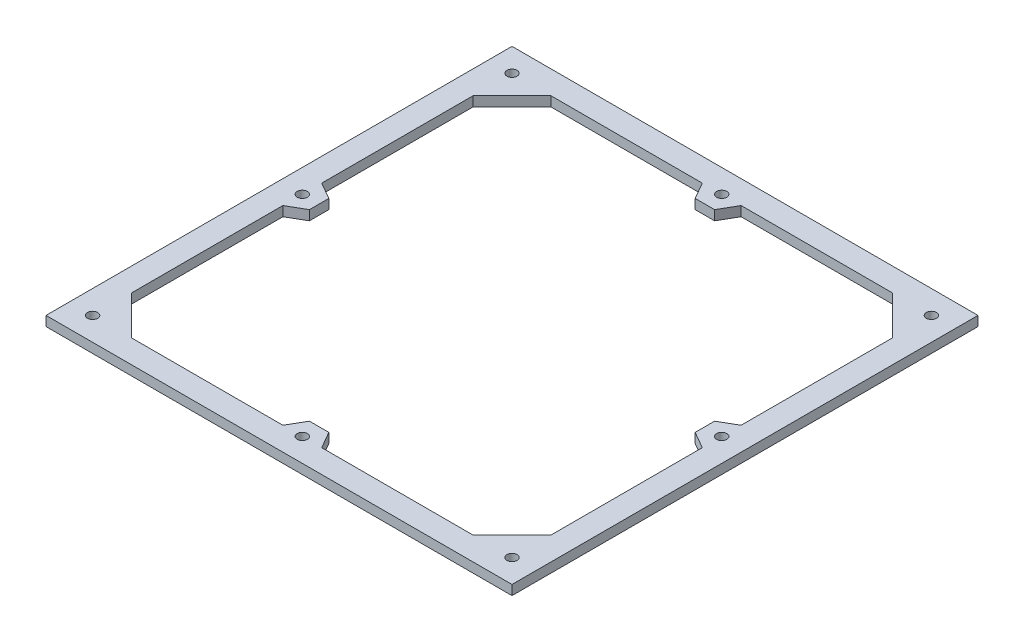
from build123d import *

# Parameters (mm, degrees)
SKETCH1_W           = 152.4
SKETCH1_H           = 152.4
SKETCH1_R           = 1.6637
BOSS_EXTRUDE4_DEPTH = 3.175


with BuildPart() as part:
    # Sketch1 → Boss-Extrude4 (new body)
    with BuildSketch(Plane(origin=(0, 0, 0), x_dir=(1, 0, 0), z_dir=(0, 1, 0))):
        with Locations((76.2, 76.2)):
            Rectangle(SKETCH1_W, SKETCH1_H)
        with Locations(Location((7.62, 7.62, 0), (0, 0, 270))):
            Circle(SKETCH1_R, mode=Mode.SUBTRACT)
        with Locations(Location((7.62, 144.78, 0), (0, 0, 270))):
            Circle(SKETCH1_R, mode=Mode.SUBTRACT)
        with Locations(Location((144.78, 144.78, 0), (0, 0, 270))):
            Circle(SKETCH1_R, mode=Mode.SUBTRACT)
        with Locations(Location((144.78, 7.62, 0), (0, 0, 270))):
            Circle(SKETCH1_R, mode=Mode.SUBTRACT)
        with Locations(Location((76.2, 7.62, 0), (0, 0, 270))):
            Circle(SKETCH1_R, mode=Mode.SUBTRACT)
        with Locations(Location((76.2, 144.78, 0), (0, 0, 270))):
            Circle(SKETCH1_R, mode=Mode.SUBTRACT)
        with Locations(Location((144.78, 76.2, 0), (0, 0, 270))):
            Circle(SKETCH1_R, mode=Mode.SUBTRACT)
        with Locations(Location((7.62, 76.2, 0), (0, 0, 270))):
            Circle(SKETCH1_R, mode=Mode.SUBTRACT)
        Polygon((69.85, 7.62), (20.32, 7.62), (7.62, 20.32), (7.62, 69.85), (13.119261314, 73.025), (13.119261314, 79.375), (7.62, 82.55), (7.62, 132.08), (20.32, 144.78), (69.85, 144.78), (73.025, 139.280738686), (79.375, 139.280738686), (82.55, 144.78), (132.08, 144.78), (144.78, 132.08), (144.78, 82.55), (139.280738686, 79.375), (139.280738686, 73.025), (144.78, 69.85), (144.78, 20.32), (132.08, 7.62), (82.55, 7.62), (79.375, 13.119261314), (73.025, 13.119261314), align=None, mode=Mode.SUBTRACT)
    extrude(amount=BOSS_EXTRUDE4_DEPTH)


solid = part.part
